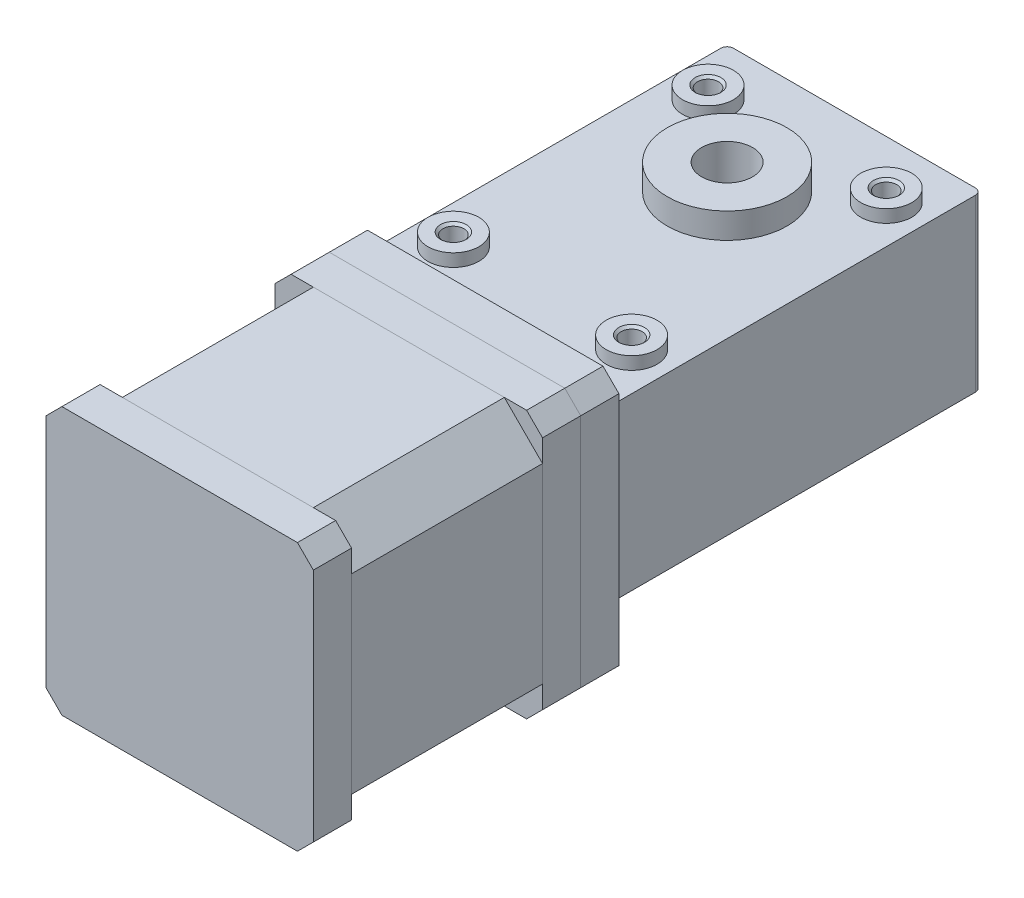
from build123d import *

# Parameters (mm, degrees)
SKETCH_1_W                  = 42
SKETCH_1_H                  = 42
EXTRUDE_1_DEPTH             = 42
CUT_EXTRUDE_1_DEPTH         = 30
CHAMFER_2_SIZE              = 2.5
EXTRUDE_2_DEPTH             = 6
SKETCH_4_W                  = 40
SKETCH_4_H                  = 26.8
EXTRUDE_3_DEPTH             = 58
CUT_EXTRUDE_2_DEPTH         = 58
SKETCH_6_R                  = 9.4
EXTRUDE_4_DEPTH             = 4
SKETCH_7_R                  = 4
EXTRUDE_5_DEPTH             = 2
SKETCH_8_R                  = 4
CUT_EXTRUDE_3_DEPTH         = 14
HOLE_WIZARD_M4_1_AT_2_COUNT = 2
HOLE_WIZARD_M4_1_AT_2_PITCH = 28
HOLE_WIZARD_M4_1_AT_3_COUNT = 2
HOLE_WIZARD_M4_1_AT_3_PITCH = 48.826222463
HOLE_WIZARD_M4_1_AT_4_COUNT = 2
HOLE_WIZARD_M4_1_AT_4_PITCH = 40
SKETCH_11_R                 = 9.4
CUT_EXTRUDE_4_DEPTH         = 0.1


with BuildPart() as part:
    # 스케치1 → 보스-돌출1 (new body)
    with BuildSketch(Plane.XY):
        Rectangle(SKETCH_1_W, SKETCH_1_H)
    extrude(amount=EXTRUDE_1_DEPTH)

    # 스케치2 → 컷-돌출1 (cut)
    with BuildSketch(Plane.XY.offset(36)):
        Polygon((-21, -21), (-15, -21), (-21, -15), align=None)
        Polygon((-21, 21), (-21, 15), (-15, 21), align=None)
        Polygon((21, 21), (15, 21), (21, 15), align=None)
        Polygon((21, -21), (21, -15), (15, -21), align=None)
    extrude(amount=-CUT_EXTRUDE_1_DEPTH, mode=Mode.SUBTRACT)

    # 모따기2
    chamfer_2_edges = [part.edges().sort_by_distance(p)[0] for p in [
        (21, -21, 3),
        (-21, -21, 3),
        (21, 21, 3),
        (-21, 21, 3),
        (21, -21, 39),
        (-21, -21, 39),
        (-21, 21, 39),
        (21, 21, 39),
    ]]
    chamfer(chamfer_2_edges, length=CHAMFER_2_SIZE)

    # 스케치3 → 보스-돌출2 (add)
    with BuildSketch(Plane(origin=(0, 0, 0), x_dir=(-1, 0, 0), z_dir=(0, 0, -1))):
        Polygon((-18.5, 21), (-21, 18.5), (-21, -18.5), (-18.5, -21), (18.5, -21), (21, -18.5), (21, 18.5), (18.5, 21), align=None)
    extrude(amount=EXTRUDE_2_DEPTH)

    # 스케치4 → 보스-돌출3 (add)
    with BuildSketch(Plane(origin=(0, 0, -6), x_dir=(-1, 0, 0), z_dir=(0, 0, -1))):
        with Locations((0, 3.1)):
            Rectangle(SKETCH_4_W, SKETCH_4_H)
    extrude(amount=EXTRUDE_3_DEPTH)

    # 스케치5 → 컷-돌출2 (cut)
    with BuildSketch(Plane(origin=(0, 16.5, 0), x_dir=(1, 0, 0), z_dir=(0, 1, 0))):
        with BuildLine():
            ThreePointArc((-20, 63), (-19.707106781, 63.707106781), (-19, 64))
            Line((-19, 64), (-20, 64))
            Line((-20, 64), (-20, 63))
        make_face()
        with BuildLine():
            Line((20, 64), (19, 64))
            ThreePointArc((19, 64), (19.707106781, 63.707106781), (20, 63))
            Line((20, 63), (20, 64))
        make_face()
        with BuildLine():
            ThreePointArc((-19, 6), (-19.707106781, 6.292893219), (-20, 7))
            Line((-20, 7), (-20, 6))
            Line((-20, 6), (-19, 6))
        make_face()
        with BuildLine():
            Line((20, 6), (20, 7))
            ThreePointArc((20, 7), (19.707106781, 6.292893219), (19, 6))
            Line((19, 6), (20, 6))
        make_face()
    extrude(amount=-CUT_EXTRUDE_2_DEPTH, mode=Mode.SUBTRACT)

    # 스케치6 → 보스-돌출4 (add)
    with BuildSketch(Plane(origin=(0, 16.5, 0), x_dir=(1, 0, 0), z_dir=(0, 1, 0))):
        with Locations((0, 44)):
            Circle(SKETCH_6_R)
    extrude_4 = extrude(amount=EXTRUDE_4_DEPTH)

    # 스케치7 → 보스-돌출5 (add)
    with BuildSketch(Plane(origin=(0, 16.5, 0), x_dir=(1, 0, 0), z_dir=(0, 1, 0))):
        with Locations((14, 55)):
            Circle(SKETCH_7_R)
        with Locations((-14, 55)):
            Circle(SKETCH_7_R)
        with Locations((-14, 15)):
            Circle(SKETCH_7_R)
        with Locations((14, 15)):
            Circle(SKETCH_7_R)
    extrude_5 = extrude(amount=EXTRUDE_5_DEPTH)

    # 스케치8 → 컷-돌출3 (cut)
    with BuildSketch(Plane(origin=(0, 20.5, 0), x_dir=(1, 0, 0), z_dir=(0, 1, 0))):
        with Locations(Location((0, 44, 0), (0, 0, 180))):
            Circle(SKETCH_8_R)
    extrude(amount=-CUT_EXTRUDE_3_DEPTH, mode=Mode.SUBTRACT)

    # 스케치10 → M4 나사 구멍1 (revolve, cut)
    with BuildSketch(Plane(origin=(-14, 18.5, -55), x_dir=(0, 0, 1), z_dir=(1, 0, 0))):
        Polygon((0, 0), (0, 12.491420021), (1.65, 11.5), (1.65, 0.375), (2.025, 0), align=None)
    hole_wizard_m4_1 = revolve(axis=Axis((-14, 24.85, -55), (0, -1, 0)), mode=Mode.SUBTRACT)

    # M4 나사 구멍1 at 2: M4 나사 구멍1 ×2
    with Locations(*[(i * HOLE_WIZARD_M4_1_AT_2_PITCH, 0, 0) for i in range(1, HOLE_WIZARD_M4_1_AT_2_COUNT)]):
        add(hole_wizard_m4_1, mode=Mode.SUBTRACT)

    # M4 나사 구멍1 at 3: M4 나사 구멍1 ×2
    with Locations(*[Vector(0.5734623443633283, 0, 0.8192319205190405) * (i * HOLE_WIZARD_M4_1_AT_3_PITCH) for i in range(1, HOLE_WIZARD_M4_1_AT_3_COUNT)]):
        add(hole_wizard_m4_1, mode=Mode.SUBTRACT)

    # M4 나사 구멍1 at 4: M4 나사 구멍1 ×2
    with Locations(*[(0, 0, i * HOLE_WIZARD_M4_1_AT_4_PITCH) for i in range(1, HOLE_WIZARD_M4_1_AT_4_COUNT)]):
        add(hole_wizard_m4_1, mode=Mode.SUBTRACT)

    # 대칭 복사1: 보스-돌출4, 보스-돌출5, M4 나사 구멍1 across plane
    add(extrude_4.mirror(Plane.ZX.offset(3.1)))
    add(extrude_5.mirror(Plane.ZX.offset(3.1)))
    add(hole_wizard_m4_1.mirror(Plane.ZX.offset(3.1)), mode=Mode.SUBTRACT)

    # 대칭 복사1 copy 1 sketch → 대칭 복사1 copy 1 (revolve, cut)
    with BuildSketch(Plane(origin=(14, -12.3, -55), x_dir=(0, 0, 1), z_dir=(1, 0, 0))):
        Polygon((0, 0), (0, -12.491420021), (1.65, -11.5), (1.65, -0.375), (2.025, 0), align=None)
    revolve(axis=Axis((14, -18.65, -55), (0, -1, 0)), mode=Mode.SUBTRACT)

    # 대칭 복사1 copy 2 sketch → 대칭 복사1 copy 2 (revolve, cut)
    with BuildSketch(Plane(origin=(14, -12.3, -15), x_dir=(0, 0, 1), z_dir=(1, 0, 0))):
        Polygon((0, 0), (0, -12.491420021), (1.65, -11.5), (1.65, -0.375), (2.025, 0), align=None)
    revolve(axis=Axis((14, -18.65, -15), (0, -1, 0)), mode=Mode.SUBTRACT)

    # 대칭 복사1 copy 3 sketch → 대칭 복사1 copy 3 (revolve, cut)
    with BuildSketch(Plane(origin=(-14, -12.3, -15), x_dir=(0, 0, 1), z_dir=(1, 0, 0))):
        Polygon((0, 0), (0, -12.491420021), (1.65, -11.5), (1.65, -0.375), (2.025, 0), align=None)
    revolve(axis=Axis((-14, -18.65, -15), (0, -1, 0)), mode=Mode.SUBTRACT)

    # 스케치11 → 컷-돌출4 (cut)
    with BuildSketch(Plane.XZ.offset(14.3)):
        with Locations(Location((0, -44, 0), (0, 0, 180))):
            Circle(SKETCH_11_R)
    extrude(amount=-CUT_EXTRUDE_4_DEPTH, mode=Mode.SUBTRACT)


solid = part.part
